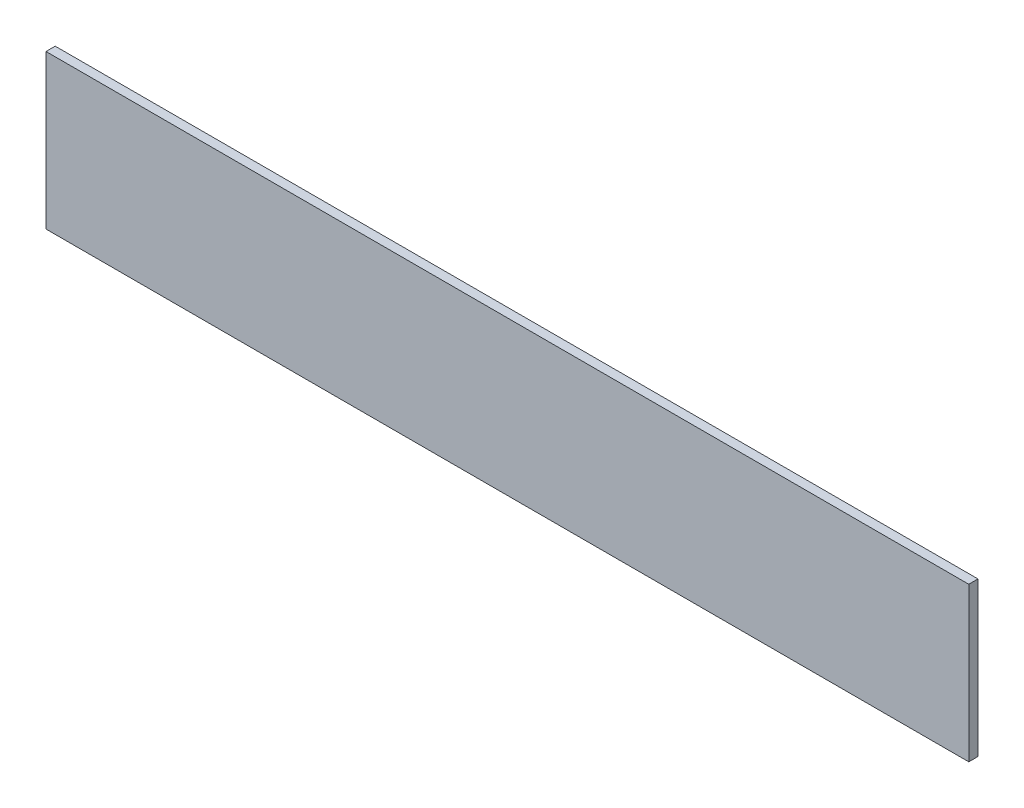
from build123d import *

# Parameters (mm, degrees)
SKETCH1_W           = 300
SKETCH1_H           = 50
BOSS_EXTRUDE1_DEPTH = 3


with BuildPart() as part:
    # Sketch1 → Boss-Extrude1 (new body)
    with BuildSketch(Plane.XY):
        with Locations((-17.03187251, 11.603585657)):
            Rectangle(SKETCH1_W, SKETCH1_H)
    extrude(amount=BOSS_EXTRUDE1_DEPTH)


solid = part.part
